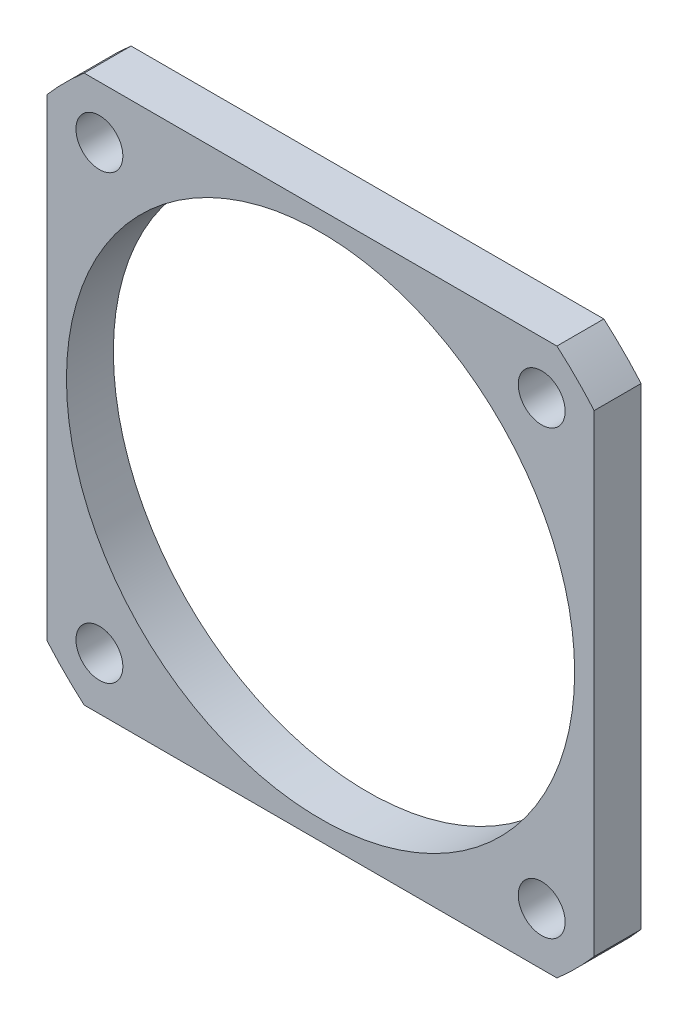
from build123d import *

# Parameters (mm, degrees)
SKETCH1_R                  = 92.5
BOSS_EXTRUDE1_DEPTH        = 12
SKETCH2_OUTSIDE_W          = 239.38
SKETCH2_OUTSIDE_H          = 239.38
SKETCH2_OUTSIDE_W_2        = 140
SKETCH2_OUTSIDE_H_2        = 140
CUT_EXTRUDE1_DEPTH         = 132.363998112
SKETCH3_R                  = 65
CUT_EXTRUDE2_DEPTH         = 100.719606899
F_12_0_12_DIAMETER_HOLE1_D = 12


with BuildPart() as part:
    # Sketch1 → Boss-Extrude1 (new body)
    with BuildSketch(Plane.XY):
        Circle(SKETCH1_R)
    extrude(amount=BOSS_EXTRUDE1_DEPTH)

    # Sketch2 outside → Cut-Extrude1 (cut, through all)
    with BuildSketch(Plane.XY.offset(12)):
        Rectangle(SKETCH2_OUTSIDE_W, SKETCH2_OUTSIDE_H)
        Rectangle(SKETCH2_OUTSIDE_W_2, SKETCH2_OUTSIDE_H_2, mode=Mode.SUBTRACT)
    extrude(amount=-CUT_EXTRUDE1_DEPTH, mode=Mode.SUBTRACT)

    # Sketch3 → Cut-Extrude2 (cut, through all)
    with BuildSketch(Plane.XY.offset(12)):
        Circle(SKETCH3_R)
    extrude(amount=-CUT_EXTRUDE2_DEPTH, mode=Mode.SUBTRACT)

    # Ø12.0 (12) Diameter Hole1 (through all)
    with Locations(Plane.XY.offset(12)):
        with Locations((56.568542495, 56.568542495), (-56.568542495, 56.568542495), (-56.568542495, -56.568542495), (56.568542495, -56.568542495)):
            Hole(F_12_0_12_DIAMETER_HOLE1_D / 2)


solid = part.part
